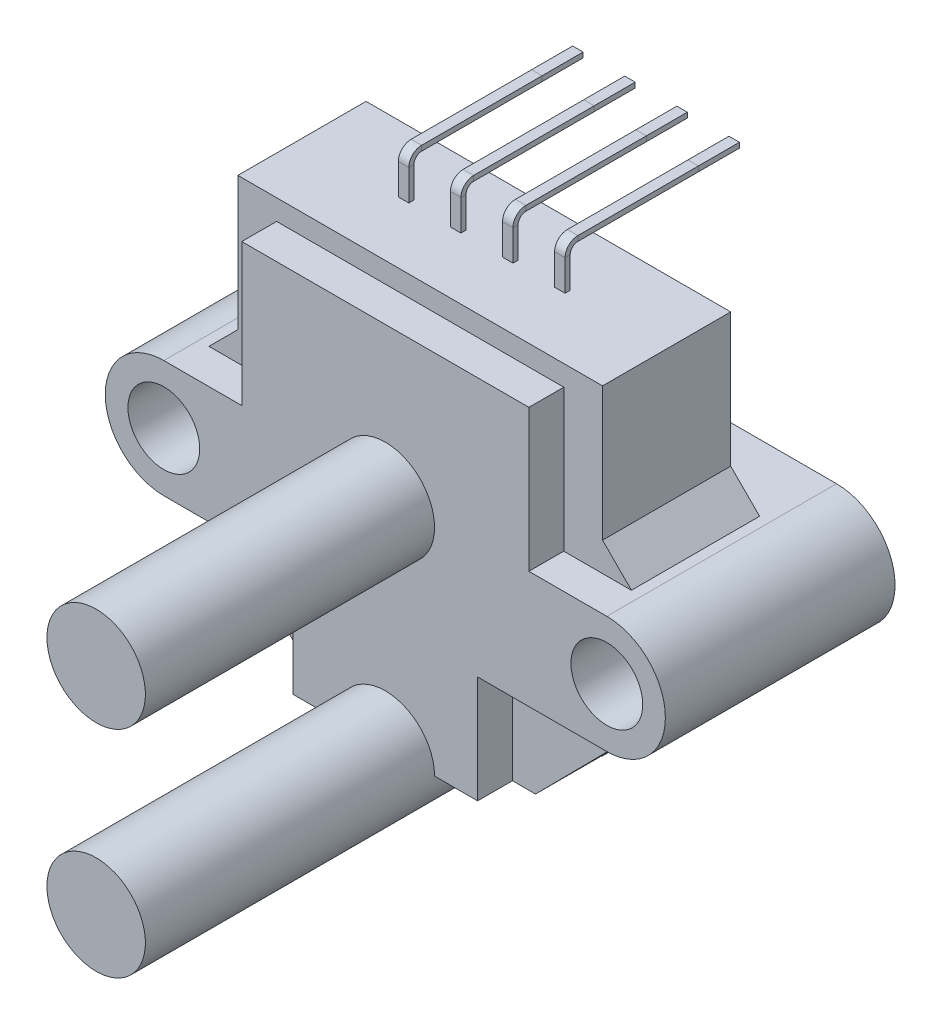
from build123d import *

# Parameters (mm, degrees)
SKETCH1_R           = 1.75
BOSS_EXTRUDE1_DEPTH = 3.25
BOSS_EXTRUDE3_START = -3.25
SKETCH1_4_R         = 1.75
BOSS_EXTRUDE3_DEPTH = 6.25
SKETCH3_W           = 9
SKETCH3_H           = 5.235
SKETCH3_R           = 1.75
SKETCH3_W_2         = 14
SKETCH3_H_2         = 6.925
BOSS_EXTRUDE4_DEPTH = 1.7
SKETCH1_5_R         = 2.4
BOSS_EXTRUDE5_DEPTH = 25.3
SKETCH5_W           = 0.51
SKETCH5_H           = 0.25
LPATTERN1_COUNT     = 4
LPATTERN1_PITCH     = 2.54


with BuildPart() as part:
    # Sketch1 → Boss-Extrude1 (new body)
    with BuildSketch(Plane(origin=(0, 0, 0), x_dir=(1, 0, 0), z_dir=(0, 0, -1))):
        with BuildLine():
            Line((-14.61, 9.925), (-7.785169808, 9.925))
            ThreePointArc((-7.785169808, 9.925), (-3.81, 6.37), (0.165169808, 9.925))
            Line((0.165169808, 9.925), (6.99, 9.925))
            ThreePointArc((6.99, 9.925), (9.845, 12.78), (6.99, 15.635))
            Line((6.99, 15.635), (0.19, 15.635))
            Line((0.19, 15.635), (0.19, 20.87))
            ThreePointArc((0.19, 20.87), (-3.81, 24.87), (-7.81, 20.87))
            Line((-7.81, 20.87), (-7.81, 15.635))
            Line((-7.81, 15.635), (-14.61, 15.635))
            ThreePointArc((-14.61, 15.635), (-17.465, 12.78), (-14.61, 9.925))
        make_face()
        with Locations(Location((-14.61, 12.78, 0), (0, 0, 180))):
            Circle(SKETCH1_R, mode=Mode.SUBTRACT)
        with Locations(Location((6.99, 12.78, 0), (0, 0, 180))):
            Circle(SKETCH1_R, mode=Mode.SUBTRACT)
    extrude(amount=-BOSS_EXTRUDE1_DEPTH)

    # Sketch1<4> → Boss-Extrude3 (add)
    with BuildSketch(Plane(origin=(0, 0, 0), x_dir=(1, 0, 0), z_dir=(0, 0, -1)).offset(BOSS_EXTRUDE3_START)):
        with BuildLine():
            Line((-12.7, 8.515), (-12.7, 2))
            Line((-12.7, 2), (5.08, 2))
            Line((5.08, 2), (5.08, 8.515))
            Line((5.08, 8.515), (6.49, 9.925))
            Line((6.49, 9.925), (6.99, 9.925))
            ThreePointArc((6.99, 9.925), (9.845, 12.78), (6.99, 15.635))
            Line((6.99, 15.635), (1.814694354, 20.87))
            Line((1.814694354, 20.87), (-9.434694354, 20.87))
            Line((-9.434694354, 20.87), (-14.61, 15.635))
            ThreePointArc((-14.61, 15.635), (-17.465, 12.78), (-14.61, 9.925))
            Line((-14.61, 9.925), (-14.11, 9.925))
            Line((-14.11, 9.925), (-12.7, 8.515))
        make_face()
        with Locations(Location((-14.61, 12.78, 0), (0, 0, 180))):
            Circle(SKETCH1_4_R, mode=Mode.SUBTRACT)
        with Locations(Location((6.99, 12.78, 0), (0, 0, 180))):
            Circle(SKETCH1_4_R, mode=Mode.SUBTRACT)
    extrude(amount=-BOSS_EXTRUDE3_DEPTH)

    # Sketch3 → Boss-Extrude4 (add)
    # profile 1 of 3: a face of its own
    with BuildSketch(Plane.XY.offset(9.5)):
        with Locations((-3.81, -18.2525)):
            Rectangle(SKETCH3_W, SKETCH3_H)
    # profile 2 of 3: a face of its own
    with BuildSketch(Plane.XY.offset(9.5)):
        with BuildLine():
            Line((6.99, -15.635), (-14.61, -15.635))
            ThreePointArc((-14.61, -15.635), (-17.465, -12.78), (-14.61, -9.925))
            Line((-14.61, -9.925), (-14.11, -9.925))
            Line((-14.11, -9.925), (6.49, -9.925))
            Line((6.49, -9.925), (6.99, -9.925))
            ThreePointArc((6.99, -9.925), (9.845, -12.78), (6.99, -15.635))
        make_face()
        with Locations(Location((-14.61, -12.78, 0), (0, 0, 180))):
            Circle(SKETCH3_R, mode=Mode.SUBTRACT)
        with Locations(Location((6.99, -12.78, 0), (0, 0, 180))):
            Circle(SKETCH3_R, mode=Mode.SUBTRACT)
    # profile 3 of 3: a face of its own
    with BuildSketch(Plane.XY.offset(9.5)):
        with Locations((-3.81, -6.4625)):
            Rectangle(SKETCH3_W_2, SKETCH3_H_2)
    extrude(amount=BOSS_EXTRUDE4_DEPTH)

    # Sketch1<5> → Boss-Extrude5 (add)
    with BuildSketch(Plane(origin=(0, 0, 0), x_dir=(1, 0, 0), z_dir=(0, 0, -1))):
        with Locations(Location((-3.81, 20.87, 0), (0, 0, 180))):
            Circle(SKETCH1_5_R)
        with Locations(Location((-3.81, 10.37, 0), (0, 0, 180))):
            Circle(SKETCH1_5_R)
    extrude(amount=-BOSS_EXTRUDE5_DEPTH)

    # Sweep1: sweep along a path in Sketch4
    with BuildLine(Plane(origin=(0, 0, 0), x_dir=(0, 0, -1), z_dir=(1, 0, 0))) as sweep1_path:
        Line((-6.375, -2), (-6.375, -0.5))
        ThreePointArc((-6.375, -0.5), (-6.228553391, -0.146446609), (-5.875, 0))
        Line((-5.875, 0), (0, 0))
        Line((0, 0), (2, 0))
    # Sketch5 → Sweep1 (sweep)
    with BuildSketch(Plane(origin=(0, -2, 0), x_dir=(1, 0, 0), z_dir=(0, 1, 0))):
        with Locations((0, -6.375)):
            Rectangle(SKETCH5_W, SKETCH5_H)
    sweep1 = sweep(path=sweep1_path.line)

    # LPattern1: Sweep1 ×4
    with Locations(*[(-i * LPATTERN1_PITCH, 0, 0) for i in range(1, LPATTERN1_COUNT)]):
        add(sweep1)


solid = part.part
